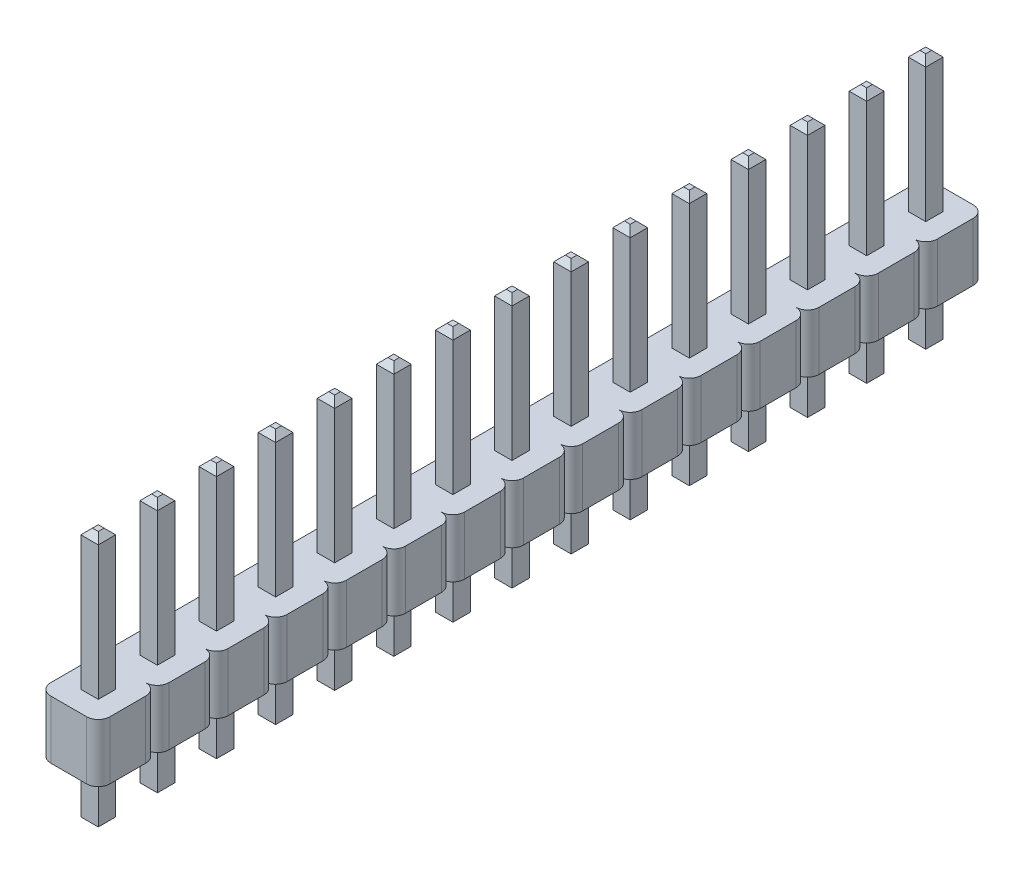
from build123d import *

# Parameters (mm, degrees)
BOSS_EXTRUDE1_DEPTH        = 2.5
LPATTERN1_COUNT            = 15
LPATTERN1_PITCH            = 2.54
BOSS_EXTRUDE2_START        = -2.5
SKETCH2_W                  = 0.75
SKETCH2_H                  = 0.75
BOSS_EXTRUDE2_DEPTH        = 11
CHAMFER1_SIZE              = 0.25
LPATTERN2_COUNT            = 15
LPATTERN2_PITCH            = 2.54
CHAMFER1_OF_LPATTERN2_SIZE = 0.25


with BuildPart() as part:
    # Sketch1 → Boss-Extrude1 (new body)
    with BuildSketch(Plane(origin=(0, 0, 0), x_dir=(-1, 0, 0), z_dir=(0, 1, 0))):
        with BuildLine():
            Line((-0.77, 1.27), (0.77, 1.27))
            ThreePointArc((0.77, 1.27), (1.123553391, 1.123553391), (1.27, 0.77))
            Line((1.27, 0.77), (1.27, -0.77))
            ThreePointArc((1.27, -0.77), (1.123553391, -1.123553391), (0.77, -1.27))
            Line((0.77, -1.27), (-0.77, -1.27))
            ThreePointArc((-0.77, -1.27), (-1.123553391, -1.123553391), (-1.27, -0.77))
            Line((-1.27, -0.77), (-1.27, 0.77))
            ThreePointArc((-1.27, 0.77), (-1.123553391, 1.123553391), (-0.77, 1.27))
        make_face()
    boss_extrude1 = extrude(amount=BOSS_EXTRUDE1_DEPTH)

    # LPattern1: Boss-Extrude1 ×15
    with Locations(*[(0, 0, i * LPATTERN1_PITCH) for i in range(1, LPATTERN1_COUNT)]):
        add(boss_extrude1)

    # Sketch2 → Boss-Extrude2 (add)
    with BuildSketch(Plane(origin=(0, 0, 0), x_dir=(-1, 0, 0), z_dir=(0, 1, 0)).offset(BOSS_EXTRUDE2_START)):
        Rectangle(SKETCH2_W, SKETCH2_H)
    boss_extrude2 = extrude(amount=BOSS_EXTRUDE2_DEPTH)

    # Chamfer1
    chamfer1_edges = [part.edges().sort_by_distance(p)[0] for p in [
        (0, -2.5, 0.375),
        (-0.375, -2.5, 0),
        (0.375, -2.5, 0),
        (0, -2.5, -0.375),
        (0, 8.5, 0.375),
        (-0.375, 8.5, 0),
        (0, 8.5, -0.375),
        (0.375, 8.5, 0),
    ]]
    chamfer(chamfer1_edges, length=CHAMFER1_SIZE)

    # LPattern2: Boss-Extrude2 ×15
    with Locations(*[(0, 0, i * LPATTERN2_PITCH) for i in range(1, LPATTERN2_COUNT)]):
        add(boss_extrude2)

    # Chamfer1 of LPattern2
    chamfer1_of_lpattern2_edges = [part.edges().sort_by_distance(p)[0] for p in [
        (0, -2.5, 2.915),
        (-0.375, -2.5, 2.54),
        (0.375, -2.5, 2.54),
        (0, -2.5, 2.165),
        (0, 8.5, 2.915),
        (-0.375, 8.5, 2.54),
        (0, 8.5, 2.165),
        (0.375, 8.5, 2.54),
        (0, -2.5, 5.455),
        (-0.375, -2.5, 5.08),
        (0.375, -2.5, 5.08),
        (0, -2.5, 4.705),
        (0, 8.5, 5.455),
        (-0.375, 8.5, 5.08),
        (0, 8.5, 4.705),
        (0.375, 8.5, 5.08),
        (0, -2.5, 7.995),
        (-0.375, -2.5, 7.62),
        (0.375, -2.5, 7.62),
        (0, -2.5, 7.245),
        (0, 8.5, 7.995),
        (-0.375, 8.5, 7.62),
        (0, 8.5, 7.245),
        (0.375, 8.5, 7.62),
        (0, -2.5, 10.535),
        (-0.375, -2.5, 10.16),
        (0.375, -2.5, 10.16),
        (0, -2.5, 9.785),
        (0, 8.5, 10.535),
        (-0.375, 8.5, 10.16),
        (0, 8.5, 9.785),
        (0.375, 8.5, 10.16),
        (0, -2.5, 13.075),
        (-0.375, -2.5, 12.7),
        (0.375, -2.5, 12.7),
        (0, -2.5, 12.325),
        (0, 8.5, 13.075),
        (-0.375, 8.5, 12.7),
        (0, 8.5, 12.325),
        (0.375, 8.5, 12.7),
        (0, -2.5, 15.615),
        (-0.375, -2.5, 15.24),
        (0.375, -2.5, 15.24),
        (0, -2.5, 14.865),
        (0, 8.5, 15.615),
        (-0.375, 8.5, 15.24),
        (0, 8.5, 14.865),
        (0.375, 8.5, 15.24),
        (0, -2.5, 18.155),
        (-0.375, -2.5, 17.78),
        (0.375, -2.5, 17.78),
        (0, -2.5, 17.405),
        (0, 8.5, 18.155),
        (-0.375, 8.5, 17.78),
        (0, 8.5, 17.405),
        (0.375, 8.5, 17.78),
        (0, -2.5, 20.695),
        (-0.375, -2.5, 20.32),
        (0.375, -2.5, 20.32),
        (0, -2.5, 19.945),
        (0, 8.5, 20.695),
        (-0.375, 8.5, 20.32),
        (0, 8.5, 19.945),
        (0.375, 8.5, 20.32),
        (0, -2.5, 23.235),
        (-0.375, -2.5, 22.86),
        (0.375, -2.5, 22.86),
        (0, -2.5, 22.485),
        (0, 8.5, 23.235),
        (-0.375, 8.5, 22.86),
        (0, 8.5, 22.485),
        (0.375, 8.5, 22.86),
        (0, -2.5, 25.775),
        (-0.375, -2.5, 25.4),
        (0.375, -2.5, 25.4),
        (0, -2.5, 25.025),
        (0, 8.5, 25.775),
        (-0.375, 8.5, 25.4),
        (0, 8.5, 25.025),
        (0.375, 8.5, 25.4),
        (0, -2.5, 28.315),
        (-0.375, -2.5, 27.94),
        (0.375, -2.5, 27.94),
        (0, -2.5, 27.565),
        (0, 8.5, 28.315),
        (-0.375, 8.5, 27.94),
        (0, 8.5, 27.565),
        (0.375, 8.5, 27.94),
        (0, -2.5, 30.855),
        (-0.375, -2.5, 30.48),
        (0.375, -2.5, 30.48),
        (0, -2.5, 30.105),
        (0, 8.5, 30.855),
        (-0.375, 8.5, 30.48),
        (0, 8.5, 30.105),
        (0.375, 8.5, 30.48),
        (0, -2.5, 33.395),
        (-0.375, -2.5, 33.02),
        (0.375, -2.5, 33.02),
        (0, -2.5, 32.645),
        (0, 8.5, 33.395),
        (-0.375, 8.5, 33.02),
        (0, 8.5, 32.645),
        (0.375, 8.5, 33.02),
        (0, -2.5, 35.935),
        (-0.375, -2.5, 35.56),
        (0.375, -2.5, 35.56),
        (0, -2.5, 35.185),
        (0, 8.5, 35.935),
        (-0.375, 8.5, 35.56),
        (0, 8.5, 35.185),
        (0.375, 8.5, 35.56),
    ]]
    chamfer(chamfer1_of_lpattern2_edges, length=CHAMFER1_OF_LPATTERN2_SIZE)


solid = part.part
